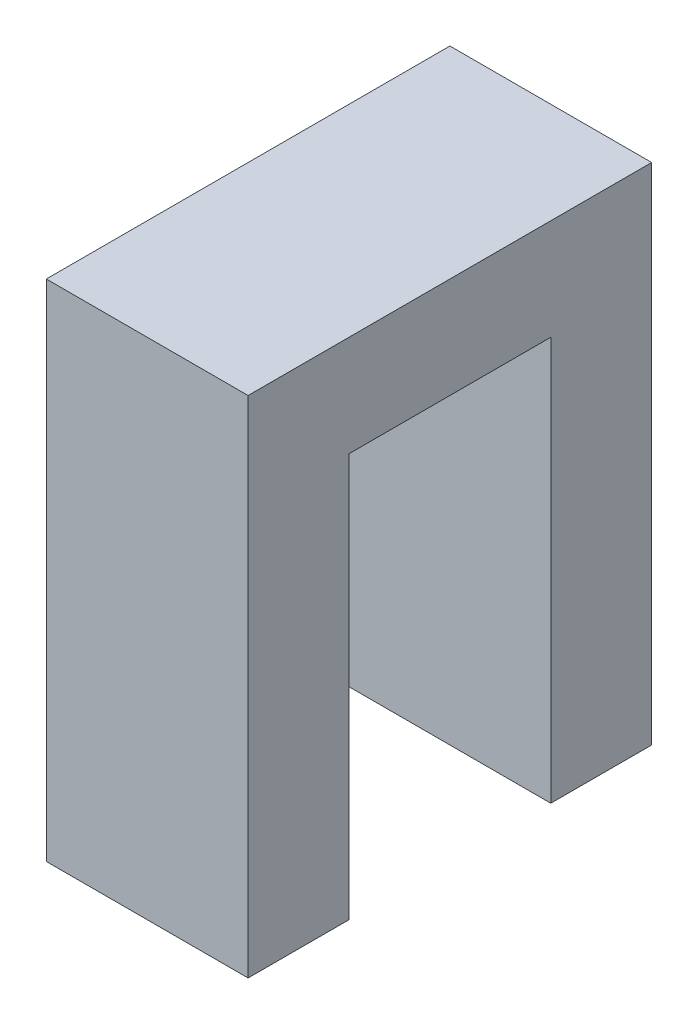
from build123d import *

# Parameters (mm, degrees)
CROQUIS1_W              = 40
CROQUIS1_H              = 100
SALIENTE_EXTRUIR1_DEPTH = 40
CROQUIS2_W              = 40
CROQUIS2_H              = 80
CORTAR_EXTRUIR1_DEPTH   = 110


with BuildPart() as part:
    # Croquis1 → Saliente-Extruir1 (new, symmetric)
    with BuildSketch(Plane.XY):
        Rectangle(CROQUIS1_W, CROQUIS1_H)
    extrude(amount=SALIENTE_EXTRUIR1_DEPTH, both=True)

    # Croquis2 → Cortar-Extruir1 (cut)
    with BuildSketch(Plane(origin=(20, 0, 0), x_dir=(0, 0, -1), z_dir=(1, 0, 0))):
        with Locations((0, -10)):
            Rectangle(CROQUIS2_W, CROQUIS2_H)
    extrude(amount=-CORTAR_EXTRUIR1_DEPTH, mode=Mode.SUBTRACT)


solid = part.part
